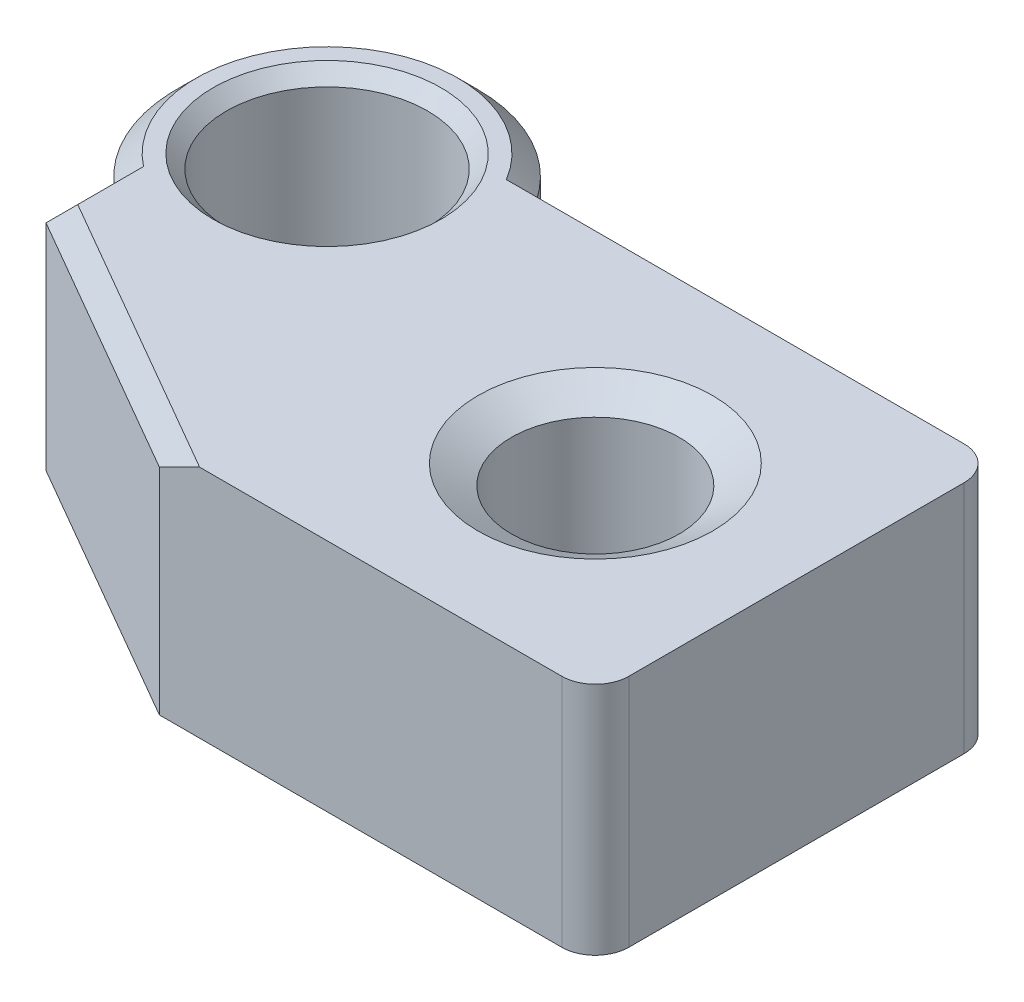
from build123d import *
from OCP.BRepFilletAPI import BRepFilletAPI_MakeChamfer

# Parameters (mm, degrees)
BOSS_EXTRUDE1_DEPTH     = 35
CUT_EXTRUDE3_DEPTH      = 84.964278119
CUT_EXTRUDE3_DEPTH_BACK = 84.964278119
SKETCH2_R               = 12.5
SKETCH2_R_2             = 15
CHAMFER1_SIZE           = 3
CHAMFER2_SIZE           = 2
CHAMFER3_SIZE           = 5
CHAMFER3_SIZE2          = 2.886751346
FILLET1_R               = 5


with BuildPart() as part:
    # Sketch1 → Boss-Extrude1 (new body)
    with BuildSketch(Plane(origin=(0, 0, 0), x_dir=(1, 0, 0), z_dir=(0, 1, 0))):
        with BuildLine():
            Line((-40, -16.905989232), (0, -40))
            Line((0, -40), (65, -40))
            Line((65, -40), (65, 20))
            Line((65, 20), (-4.844355629, 20))
            ThreePointArc((-4.844355629, 20), (-38.631222116, 27.900831925), (-40, -6.770509831))
            Line((-40, -6.770509831), (-40, -16.905989232))
        make_face()
    extrude(amount=BOSS_EXTRUDE1_DEPTH)

    # Sketch2 → Cut-Extrude3 (cut, two sides: drawn at the far end of the back side and taken through both)
    with BuildSketch(Plane(origin=(0, 0, 0), x_dir=(1, 0, 0), z_dir=(0, 1, 0)).offset(-CUT_EXTRUDE3_DEPTH_BACK)):
        with Locations(Location((35, -10, 0), (0, 0, 270))):
            Circle(SKETCH2_R)
        with Locations(Location((-25, 10, 0), (0, 0, 270))):
            Circle(SKETCH2_R_2)
    extrude(amount=CUT_EXTRUDE3_DEPTH + CUT_EXTRUDE3_DEPTH_BACK, mode=Mode.SUBTRACT)

    # Chamfer1
    chamfer1_edges = [part.edges().sort_by_distance(p)[0] for p in [
        (-20, 35, 28.452994616),
        (-40, 35, 11.838249532),
        (-38.631222116, 35, -27.900831925),
    ]]
    chamfer(chamfer1_edges, length=CHAMFER1_SIZE)

    # Chamfer2
    chamfer2_edges = [part.edges().sort_by_distance(p)[0] for p in [
        (-25, 0, -25),
        (-25, 35, -25),
    ]]
    chamfer(chamfer2_edges, length=CHAMFER2_SIZE)

    # Chamfer3: one chamfer whose edges measure the first distance from different faces: ONE call of the kernel's chamfer builder (chamfer() names one face for all edges)
    chamfer3_edges_1 = [part.edges().sort_by_distance(p)[0] for p in [
        (35, 0, -2.5),
    ]]
    chamfer3_side_1 = [part.faces().sort_by_distance(p)[0] for p in [
        (35, 17.5, -2.5),
    ]]
    chamfer3_edges_2 = [part.edges().sort_by_distance(p)[0] for p in [
        (35, 35, -2.5),
    ]]
    chamfer3_side_2 = [part.faces().sort_by_distance(p)[0] for p in [
        (20.131502665, 35, 9.160583392),
    ]]
    chamfer3 = BRepFilletAPI_MakeChamfer(part.part.solid().wrapped)
    for e in chamfer3_edges_1:
        chamfer3.Add(CHAMFER3_SIZE, CHAMFER3_SIZE2, e.wrapped, chamfer3_side_1[0].wrapped)  # the first distance lies on this face
    for e in chamfer3_edges_2:
        chamfer3.Add(CHAMFER3_SIZE, CHAMFER3_SIZE2, e.wrapped, chamfer3_side_2[0].wrapped)  # the first distance lies on this face
    add(Compound.cast(chamfer3.Shape()), mode=Mode.REPLACE)

    # Fillet1
    fillet1_edges = [part.edges().sort_by_distance(p)[0] for p in [
        (65, 17.5, 40),
        (65, 17.5, -20),
        (-4.844355629, 16, -20),
    ]]
    fillet(fillet1_edges, radius=FILLET1_R)


solid = part.part
